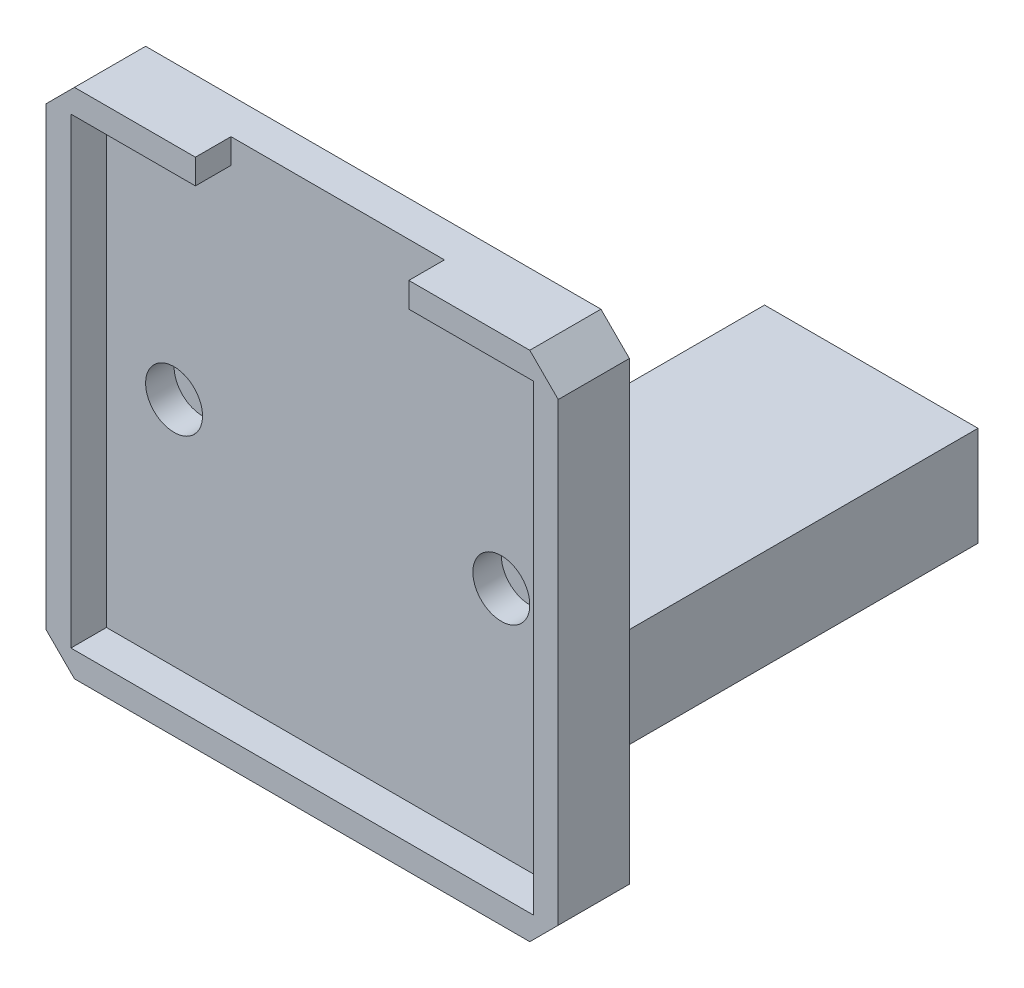
from build123d import *

# Parameters (mm, degrees)
SKETCH3_W           = 36
SKETCH3_H           = 36
BOSS_EXTRUDE2_DEPTH = 5
SKETCH4_W           = 32.5
SKETCH4_H           = 32.5
SKETCH4_W_2         = 15
SKETCH4_H_2         = 1.75
CUT_EXTRUDE1_DEPTH  = 2.5
SKETCH6_W           = 35
SKETCH6_H           = 7
BOSS_EXTRUDE3_DEPTH = 7.5
CHAMFER1_SIZE       = 5
CHAMFER2_SIZE       = 2
SKETCH7_R           = 2
CUT_EXTRUDE2_DEPTH  = 2
CHAMFER3_SIZE       = 2


with BuildPart() as part:
    # Sketch3 → Boss-Extrude2 (new body)
    with BuildSketch(Plane.XY):
        Rectangle(SKETCH3_W, SKETCH3_H)
    extrude(amount=BOSS_EXTRUDE2_DEPTH)

    # Sketch4 → Cut-Extrude1 (cut)
    with BuildSketch(Plane.XY.offset(5)):
        Rectangle(SKETCH4_W, SKETCH4_H)
        with Locations((0, 17.125)):
            Rectangle(SKETCH4_W_2, SKETCH4_H_2)
    extrude(amount=-CUT_EXTRUDE1_DEPTH, mode=Mode.SUBTRACT)

    # Sketch6 → Boss-Extrude3 (add, symmetric)
    with BuildSketch(Plane(origin=(0, 0, 0), x_dir=(0, 0, -1), z_dir=(1, 0, 0))):
        with Locations((17.5, -14.5)):
            Rectangle(SKETCH6_W, SKETCH6_H)
    extrude(amount=BOSS_EXTRUDE3_DEPTH, both=True)

    # Chamfer1
    chamfer1_edges = [part.edges().sort_by_distance(p)[0] for p in [
        (-7.5, -14.5, 0),
        (7.5, -14.5, 0),
    ]]
    chamfer(chamfer1_edges, length=CHAMFER1_SIZE)

    # Chamfer2
    chamfer2_edges = [part.edges().sort_by_distance(p)[0] for p in [
        (18, -18, 2.5),
        (-18, -18, 2.5),
        (-18, 18, 2.5),
        (18, 18, 2.5),
    ]]
    chamfer(chamfer2_edges, length=CHAMFER2_SIZE)

    # Sketch7 → Cut-Extrude2 (cut)
    with BuildSketch(Plane.XY.offset(2.5)):
        with Locations((-11.5, 0)):
            Circle(SKETCH7_R)
        with Locations(Location((11.5, 0, 0), (0, 0, 180))):
            Circle(SKETCH7_R)
    extrude(amount=-CUT_EXTRUDE2_DEPTH, mode=Mode.SUBTRACT)

    # Chamfer3
    chamfer3_edges = [part.edges().sort_by_distance(p)[0] for p in [
        (0, -11, 0),
    ]]
    chamfer(chamfer3_edges, length=CHAMFER3_SIZE)


solid = part.part
